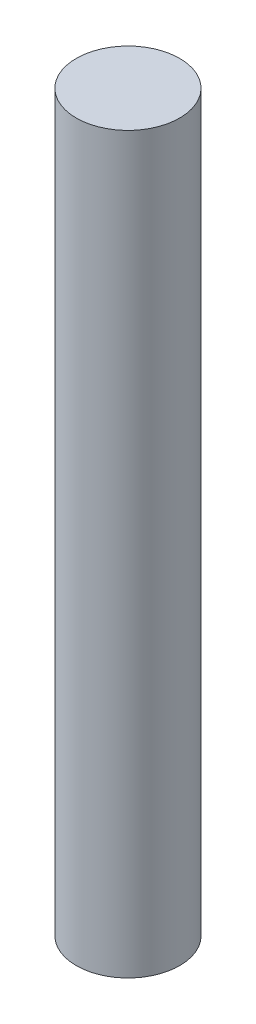
from build123d import *

# Parameters (mm, degrees)
ESQUISSE1_R        = 5
BOSS_EXTRU_1_DEPTH = 71


with BuildPart() as part:
    # Esquisse1 → Boss.-Extru.1 (new body)
    with BuildSketch(Plane(origin=(0, 0, 0), x_dir=(1, 0, 0), z_dir=(0, 1, 0))):
        with Locations(Location((0, 0, 0), (0, 0, 270))):
            Circle(ESQUISSE1_R)
    extrude(amount=-BOSS_EXTRU_1_DEPTH)


solid = part.part
